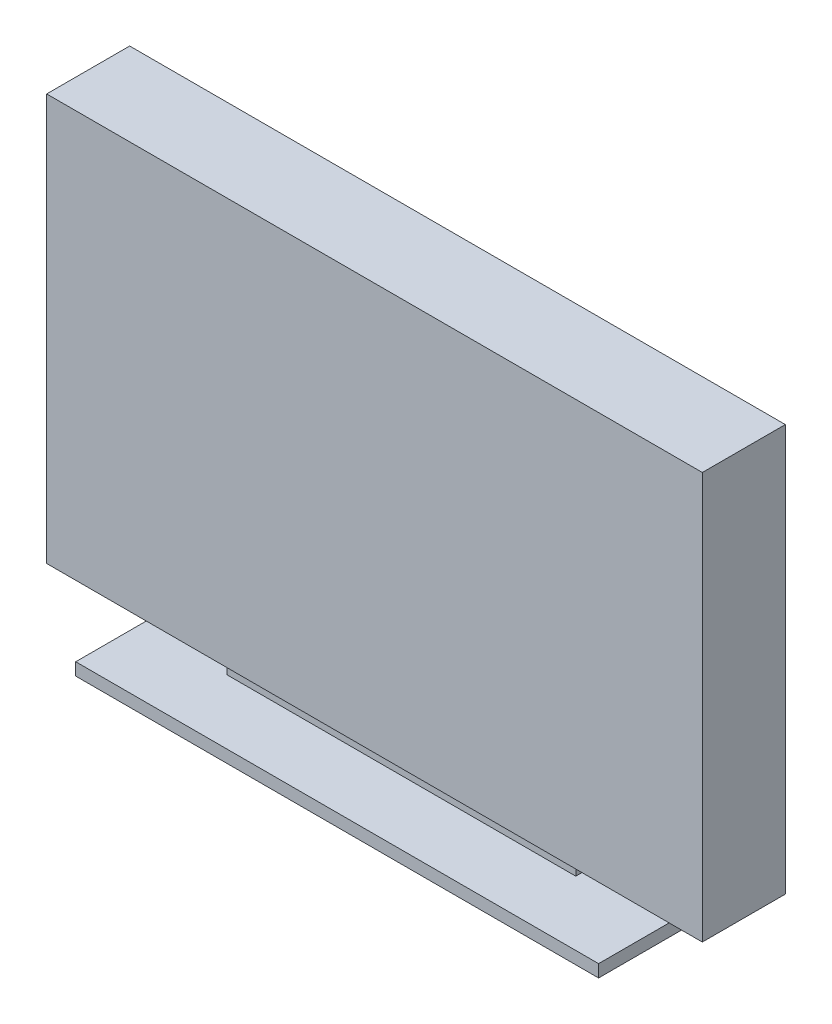
from build123d import *

# Parameters (mm, degrees)
SKETCH1_W           = 630
SKETCH1_H           = 190
BOSS_EXTRUDE1_DEPTH = 15
SKETCH3_W           = 420
SKETCH3_H           = 35
BOSS_EXTRUDE2_DEPTH = 40
SKETCH4_W           = 790
SKETCH4_H           = 100
BOSS_EXTRUDE3_DEPTH = 490


with BuildPart() as part:
    # Sketch1 → Boss-Extrude1 (new body)
    with BuildSketch(Plane(origin=(0, 0, 0), x_dir=(1, 0, 0), z_dir=(0, 1, 0))):
        Rectangle(SKETCH1_W, SKETCH1_H)
    extrude(amount=BOSS_EXTRUDE1_DEPTH)

    # Sketch3 → Boss-Extrude2 (add)
    with BuildSketch(Plane(origin=(0, 15, 0), x_dir=(1, 0, 0), z_dir=(0, 1, 0))):
        Rectangle(SKETCH3_W, SKETCH3_H)
    extrude(amount=BOSS_EXTRUDE2_DEPTH)

    # Sketch4 → Boss-Extrude3 (add)
    with BuildSketch(Plane(origin=(0, 55, 0), x_dir=(1, 0, 0), z_dir=(0, 1, 0))):
        Rectangle(SKETCH4_W, SKETCH4_H)
    extrude(amount=BOSS_EXTRUDE3_DEPTH)


solid = part.part
